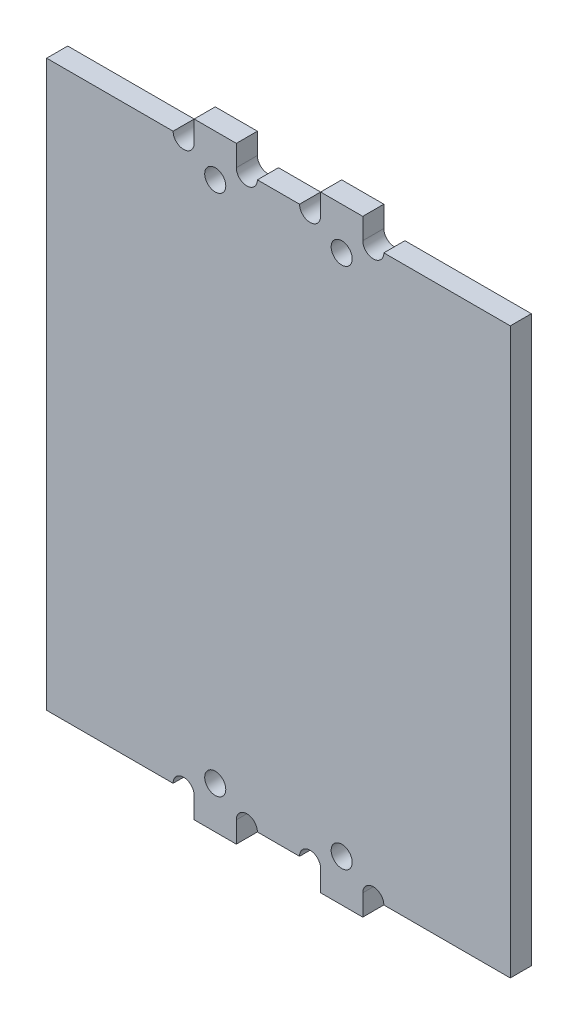
from build123d import *

# Parameters (mm, degrees)
SKETCH_1_R      = 1
EXTRUDE_1_DEPTH = 2


with BuildPart() as part:
    # 草圖1 → 填料-伸長1 (new body)
    with BuildSketch(Plane.XY):
        with BuildLine():
            Line((-13.655498481, 25.979826384), (-13.655498481, 26.979826384))
            Line((-13.655498481, 26.979826384), (-12.655498481, 26.979826384))
            Line((-12.655498481, 26.979826384), (-1.655498481, 26.979826384))
            ThreePointArc((-1.655498481, 26.979826384), (-0.655498481, 25.979826384), (0.344501519, 26.979826384))
            Line((0.344501519, 26.979826384), (0.344501519, 28.979826384))
            Line((0.344501519, 28.979826384), (4.344501519, 28.979826384))
            Line((4.344501519, 28.979826384), (4.344501519, 26.979826384))
            ThreePointArc((4.344501519, 26.979826384), (5.344501519, 25.979826384), (6.344501519, 26.979826384))
            Line((6.344501519, 26.979826384), (10.344501519, 26.979826384))
            ThreePointArc((10.344501519, 26.979826384), (11.344501519, 25.979826384), (12.344501519, 26.979826384))
            Line((12.344501519, 26.979826384), (12.344501519, 28.979826384))
            Line((12.344501519, 28.979826384), (16.344501519, 28.979826384))
            Line((16.344501519, 28.979826384), (16.344501519, 26.979826384))
            ThreePointArc((16.344501519, 26.979826384), (17.344501519, 25.979826384), (18.344501519, 26.979826384))
            Line((18.344501519, 26.979826384), (29.344501519, 26.979826384))
            Line((29.344501519, 26.979826384), (30.344501519, 26.979826384))
            Line((30.344501519, 26.979826384), (30.344501519, 25.979826384))
            Line((30.344501519, 25.979826384), (30.344501519, -26.620173616))
            Line((30.344501519, -26.620173616), (29.344501519, -26.620173616))
            Line((29.344501519, -26.620173616), (18.344501519, -26.620173616))
            ThreePointArc((18.344501519, -26.620173616), (17.344501519, -25.620173616), (16.344501519, -26.620173616))
            Line((16.344501519, -26.620173616), (16.344501519, -28.620173616))
            Line((16.344501519, -28.620173616), (12.344501519, -28.620173616))
            Line((12.344501519, -28.620173616), (12.344501519, -26.620173616))
            ThreePointArc((12.344501519, -26.620173616), (11.344501519, -25.620173616), (10.344501519, -26.620173616))
            Line((10.344501519, -26.620173616), (6.344501519, -26.620173616))
            ThreePointArc((6.344501519, -26.620173616), (5.344501519, -25.620173616), (4.344501519, -26.620173616))
            Line((4.344501519, -26.620173616), (4.344501519, -28.620173616))
            Line((4.344501519, -28.620173616), (0.344501519, -28.620173616))
            Line((0.344501519, -28.620173616), (0.344501519, -26.620173616))
            ThreePointArc((0.344501519, -26.620173616), (-0.655498481, -25.620173616), (-1.655498481, -26.620173616))
            Line((-1.655498481, -26.620173616), (-12.655498481, -26.620173616))
            Line((-12.655498481, -26.620173616), (-13.655498481, -26.620173616))
            Line((-13.655498481, -26.620173616), (-13.655498481, 25.979826384))
        make_face()
        with Locations((14.344501519, 24.979826384)):
            Circle(SKETCH_1_R, mode=Mode.SUBTRACT)
        with Locations((2.344501519, -24.620173616)):
            Circle(SKETCH_1_R, mode=Mode.SUBTRACT)
        with Locations((14.344501519, -24.620173616)):
            Circle(SKETCH_1_R, mode=Mode.SUBTRACT)
        with Locations((2.344501519, 24.979826384)):
            Circle(SKETCH_1_R, mode=Mode.SUBTRACT)
    extrude(amount=EXTRUDE_1_DEPTH)


solid = part.part
